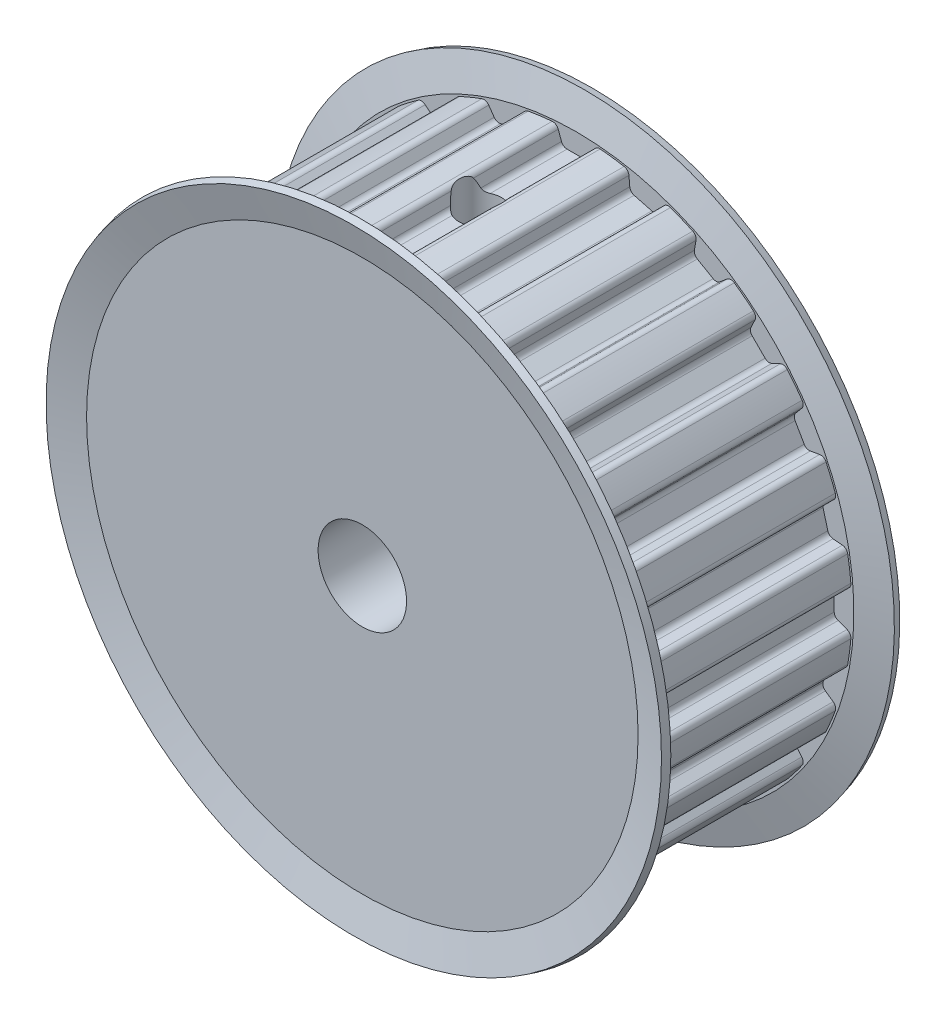
from build123d import *

# Parameters (mm, degrees)
SKETCH5_W           = 15
SKETCH5_H           = 18.7
SKETCH16_W          = 6
SKETCH16_H          = 13
SKETCH17_W          = 21
SKETCH17_H          = 3
SKETCH19_W          = 1.433256124
SKETCH19_H          = 51
CUT_TOOTH_REACH     = 35.77
PATTERN_TOOTH_COUNT = 24


with BuildPart() as part:
    # Sketch5 → body (revolve)
    with BuildSketch(Plane(origin=(0, 0, 0), x_dir=(0, 0, -1), z_dir=(1, 0, 0)), mode=Mode.PRIVATE) as body_sk:
        with Locations((7.5, 9.35)):
            Rectangle(SKETCH5_W, SKETCH5_H)
    revolve(body_sk.sketch.rotate(Axis((0, 0, 0), (0, 0, -1)), 90), axis=Axis((0, 0, 0), (0, 0, -1)))

    # Sketch16 → body-hub (revolve)
    with BuildSketch(Plane(origin=(0, 0, 0), x_dir=(0, 0, -1), z_dir=(1, 0, 0))):
        with Locations((18, 6.5)):
            Rectangle(SKETCH16_W, SKETCH16_H)
    revolve(axis=Axis((0, 0, -21), (0, 0, 1)))

    # Sketch17 → body-bore (revolve, cut)
    with BuildSketch(Plane(origin=(0, 0, 0), x_dir=(0, 0, -1), z_dir=(1, 0, 0))):
        with Locations((10.5, 1.5)):
            Rectangle(SKETCH17_W, SKETCH17_H)
    revolve(axis=Axis((0, 0, -21), (0, 0, 1)), mode=Mode.SUBTRACT)

    # Sketch19 → body-stop-screw-hole (revolve, cut)
    with BuildSketch(Plane(origin=(0, 0, 0), x_dir=(0, 0, -1), z_dir=(1, 0, 0))):
        with Locations((8.716628062, 24.5)):
            Rectangle(SKETCH19_W, SKETCH19_H)
    revolve(axis=Axis((0, -1, -8), (0, 1, 0)), mode=Mode.SUBTRACT)

    # Sketch23 → cut-tooth (cut, up to next)
    with BuildSketch(Plane.XY, mode=Mode.PRIVATE) as cut_tooth_sk1:
        with BuildLine():
            Line((1.626397051, 19.829139342), (-1.626397051, 19.829139342))
            Line((-1.626397051, 19.829139342), (-1.626397051, 18.629139342))
            ThreePointArc((-1.626397051, 18.629139342), (-1.376657042, 18.567991954), (-1.215730761, 18.367463136))
            Line((-1.215730761, 18.367463136), (-0.995794033, 17.763191943))
            ThreePointArc((-0.995794033, 17.763191943), (-0.849347559, 17.572339182), (-0.619916985, 17.5))
            Line((-0.619916985, 17.5), (0.619916985, 17.5))
            ThreePointArc((0.619916985, 17.5), (0.849347559, 17.572339182), (0.995794033, 17.763191943))
            Line((0.995794033, 17.763191943), (1.215730761, 18.367463136))
            ThreePointArc((1.215730761, 18.367463136), (1.376657042, 18.567991954), (1.626397051, 18.629139342))
            Line((1.626397051, 18.629139342), (1.626397051, 19.829139342))
        make_face()
    cut_tooth_tool1 = extrude(cut_tooth_sk1.sketch, amount=-CUT_TOOTH_REACH, mode=Mode.PRIVATE) & part.part
    cut_tooth = cut_tooth_tool1.solids().sort_by_distance((0, 18.793074, 0))[0]
    add(cut_tooth, mode=Mode.SUBTRACT)

    # pattern-tooth: cut-tooth; each copy of cut-tooth runs up to whatever stops it at its own place
    pattern_tooth_before = part.part  # the part as the pattern finds it: every copy runs up to it
    pattern_tooth_cut_tooth_long = extrude(cut_tooth_sk1.sketch, amount=-CUT_TOOTH_REACH, mode=Mode.PRIVATE)
    pattern_tooth_cut_tooth_tool1 = pattern_tooth_cut_tooth_long.rotate(Axis((0, 0, -15), (0, 0, 1)), 1 * 360 / PATTERN_TOOTH_COUNT) & pattern_tooth_before
    add(pattern_tooth_cut_tooth_tool1.solids().sort_by_distance((-4.864005, 18.152716, 0))[0], mode=Mode.SUBTRACT)
    pattern_tooth_cut_tooth_tool2 = pattern_tooth_cut_tooth_long.rotate(Axis((0, 0, -15), (0, 0, 1)), 2 * 360 / PATTERN_TOOTH_COUNT) & pattern_tooth_before
    add(pattern_tooth_cut_tooth_tool2.solids().sort_by_distance((-9.396537, 16.275279, 0))[0], mode=Mode.SUBTRACT)
    pattern_tooth_cut_tooth_tool3 = pattern_tooth_cut_tooth_long.rotate(Axis((0, 0, -15), (0, 0, 1)), 3 * 360 / PATTERN_TOOTH_COUNT) & pattern_tooth_before
    add(pattern_tooth_cut_tooth_tool3.solids().sort_by_distance((-13.28871, 13.28871, 0))[0], mode=Mode.SUBTRACT)
    pattern_tooth_cut_tooth_tool4 = pattern_tooth_cut_tooth_long.rotate(Axis((0, 0, -15), (0, 0, 1)), 4 * 360 / PATTERN_TOOTH_COUNT) & pattern_tooth_before
    add(pattern_tooth_cut_tooth_tool4.solids().sort_by_distance((-16.275279, 9.396537, 0))[0], mode=Mode.SUBTRACT)
    pattern_tooth_cut_tooth_tool5 = pattern_tooth_cut_tooth_long.rotate(Axis((0, 0, -15), (0, 0, 1)), 5 * 360 / PATTERN_TOOTH_COUNT) & pattern_tooth_before
    add(pattern_tooth_cut_tooth_tool5.solids().sort_by_distance((-18.152716, 4.864005, 0))[0], mode=Mode.SUBTRACT)
    pattern_tooth_cut_tooth_tool6 = pattern_tooth_cut_tooth_long.rotate(Axis((0, 0, -15), (0, 0, 1)), 6 * 360 / PATTERN_TOOTH_COUNT) & pattern_tooth_before
    add(pattern_tooth_cut_tooth_tool6.solids().sort_by_distance((-18.793074, 0, 0))[0], mode=Mode.SUBTRACT)
    pattern_tooth_cut_tooth_tool7 = pattern_tooth_cut_tooth_long.rotate(Axis((0, 0, -15), (0, 0, 1)), 7 * 360 / PATTERN_TOOTH_COUNT) & pattern_tooth_before
    add(pattern_tooth_cut_tooth_tool7.solids().sort_by_distance((-18.152716, -4.864005, 0))[0], mode=Mode.SUBTRACT)
    pattern_tooth_cut_tooth_tool8 = pattern_tooth_cut_tooth_long.rotate(Axis((0, 0, -15), (0, 0, 1)), 8 * 360 / PATTERN_TOOTH_COUNT) & pattern_tooth_before
    add(pattern_tooth_cut_tooth_tool8.solids().sort_by_distance((-16.275279, -9.396537, 0))[0], mode=Mode.SUBTRACT)
    pattern_tooth_cut_tooth_tool9 = pattern_tooth_cut_tooth_long.rotate(Axis((0, 0, -15), (0, 0, 1)), 9 * 360 / PATTERN_TOOTH_COUNT) & pattern_tooth_before
    add(pattern_tooth_cut_tooth_tool9.solids().sort_by_distance((-13.28871, -13.28871, 0))[0], mode=Mode.SUBTRACT)
    pattern_tooth_cut_tooth_tool10 = pattern_tooth_cut_tooth_long.rotate(Axis((0, 0, -15), (0, 0, 1)), 10 * 360 / PATTERN_TOOTH_COUNT) & pattern_tooth_before
    add(pattern_tooth_cut_tooth_tool10.solids().sort_by_distance((-9.396537, -16.275279, 0))[0], mode=Mode.SUBTRACT)
    pattern_tooth_cut_tooth_tool11 = pattern_tooth_cut_tooth_long.rotate(Axis((0, 0, -15), (0, 0, 1)), 11 * 360 / PATTERN_TOOTH_COUNT) & pattern_tooth_before
    add(pattern_tooth_cut_tooth_tool11.solids().sort_by_distance((-4.864005, -18.152716, 0))[0], mode=Mode.SUBTRACT)
    pattern_tooth_cut_tooth_tool12 = pattern_tooth_cut_tooth_long.rotate(Axis((0, 0, -15), (0, 0, 1)), 12 * 360 / PATTERN_TOOTH_COUNT) & pattern_tooth_before
    add(pattern_tooth_cut_tooth_tool12.solids().sort_by_distance((0, -18.793074, 0))[0], mode=Mode.SUBTRACT)
    pattern_tooth_cut_tooth_tool13 = pattern_tooth_cut_tooth_long.rotate(Axis((0, 0, -15), (0, 0, 1)), 13 * 360 / PATTERN_TOOTH_COUNT) & pattern_tooth_before
    add(pattern_tooth_cut_tooth_tool13.solids().sort_by_distance((4.864005, -18.152716, 0))[0], mode=Mode.SUBTRACT)
    pattern_tooth_cut_tooth_tool14 = pattern_tooth_cut_tooth_long.rotate(Axis((0, 0, -15), (0, 0, 1)), 14 * 360 / PATTERN_TOOTH_COUNT) & pattern_tooth_before
    add(pattern_tooth_cut_tooth_tool14.solids().sort_by_distance((9.396537, -16.275279, 0))[0], mode=Mode.SUBTRACT)
    pattern_tooth_cut_tooth_tool15 = pattern_tooth_cut_tooth_long.rotate(Axis((0, 0, -15), (0, 0, 1)), 15 * 360 / PATTERN_TOOTH_COUNT) & pattern_tooth_before
    add(pattern_tooth_cut_tooth_tool15.solids().sort_by_distance((13.28871, -13.28871, 0))[0], mode=Mode.SUBTRACT)
    pattern_tooth_cut_tooth_tool16 = pattern_tooth_cut_tooth_long.rotate(Axis((0, 0, -15), (0, 0, 1)), 16 * 360 / PATTERN_TOOTH_COUNT) & pattern_tooth_before
    add(pattern_tooth_cut_tooth_tool16.solids().sort_by_distance((16.275279, -9.396537, 0))[0], mode=Mode.SUBTRACT)
    pattern_tooth_cut_tooth_tool17 = pattern_tooth_cut_tooth_long.rotate(Axis((0, 0, -15), (0, 0, 1)), 17 * 360 / PATTERN_TOOTH_COUNT) & pattern_tooth_before
    add(pattern_tooth_cut_tooth_tool17.solids().sort_by_distance((18.152716, -4.864005, 0))[0], mode=Mode.SUBTRACT)
    pattern_tooth_cut_tooth_tool18 = pattern_tooth_cut_tooth_long.rotate(Axis((0, 0, -15), (0, 0, 1)), 18 * 360 / PATTERN_TOOTH_COUNT) & pattern_tooth_before
    add(pattern_tooth_cut_tooth_tool18.solids().sort_by_distance((18.793074, 0, 0))[0], mode=Mode.SUBTRACT)
    pattern_tooth_cut_tooth_tool19 = pattern_tooth_cut_tooth_long.rotate(Axis((0, 0, -15), (0, 0, 1)), 19 * 360 / PATTERN_TOOTH_COUNT) & pattern_tooth_before
    add(pattern_tooth_cut_tooth_tool19.solids().sort_by_distance((18.152716, 4.864005, 0))[0], mode=Mode.SUBTRACT)
    pattern_tooth_cut_tooth_tool20 = pattern_tooth_cut_tooth_long.rotate(Axis((0, 0, -15), (0, 0, 1)), 20 * 360 / PATTERN_TOOTH_COUNT) & pattern_tooth_before
    add(pattern_tooth_cut_tooth_tool20.solids().sort_by_distance((16.275279, 9.396537, 0))[0], mode=Mode.SUBTRACT)
    pattern_tooth_cut_tooth_tool21 = pattern_tooth_cut_tooth_long.rotate(Axis((0, 0, -15), (0, 0, 1)), 21 * 360 / PATTERN_TOOTH_COUNT) & pattern_tooth_before
    add(pattern_tooth_cut_tooth_tool21.solids().sort_by_distance((13.28871, 13.28871, 0))[0], mode=Mode.SUBTRACT)
    pattern_tooth_cut_tooth_tool22 = pattern_tooth_cut_tooth_long.rotate(Axis((0, 0, -15), (0, 0, 1)), 22 * 360 / PATTERN_TOOTH_COUNT) & pattern_tooth_before
    add(pattern_tooth_cut_tooth_tool22.solids().sort_by_distance((9.396537, 16.275279, 0))[0], mode=Mode.SUBTRACT)
    pattern_tooth_cut_tooth_tool23 = pattern_tooth_cut_tooth_long.rotate(Axis((0, 0, -15), (0, 0, 1)), 23 * 360 / PATTERN_TOOTH_COUNT) & pattern_tooth_before
    add(pattern_tooth_cut_tooth_tool23.solids().sort_by_distance((4.864005, 18.152716, 0))[0], mode=Mode.SUBTRACT)

    # Sketch25 → body-flange-front (revolve)
    with BuildSketch(Plane(origin=(0, 0, 0), x_dir=(0, 0, -1), z_dir=(1, 0, 0)), mode=Mode.PRIVATE) as body_flange_front_sk:
        Polygon((0.5, 16.625), (0, 16.625), (0, 18.7), (-0.580384758, 20.866025404), (-0.080384758, 21), (0.5, 18.833974596), align=None)
    revolve(body_flange_front_sk.sketch.rotate(Axis((0, 0, 0), (0, 0, -1)), 90), axis=Axis((0, 0, 0), (0, 0, -1)))

    # Sketch26 → body-flange-back (revolve)
    with BuildSketch(Plane(origin=(0, 0, 0), x_dir=(0, 0, -1), z_dir=(1, 0, 0))):
        Polygon((14.5, 16.625), (15, 16.625), (15, 18.7), (15.580384758, 20.866025404), (15.080384758, 21), (14.5, 18.833974596), align=None)
    revolve(axis=Axis((0, 0, -15), (0, 0, 1)))


solid = part.part
